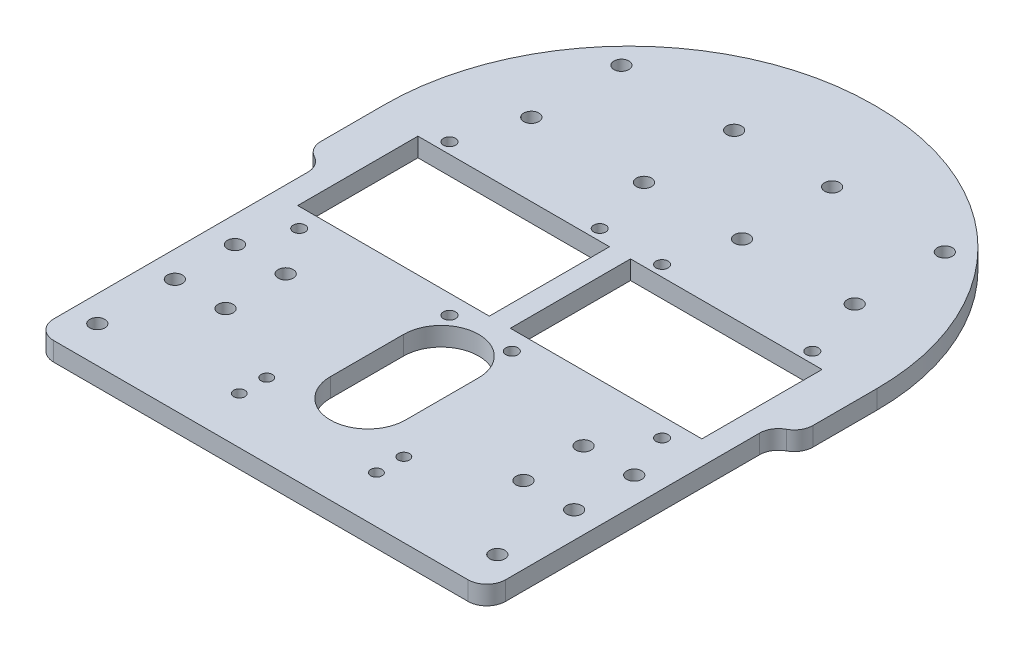
from build123d import *

# Parameters (mm, degrees)
BOSS_EXTRUDE2_DEPTH = 5
FILLET8_R           = 65
SKETCH4_R           = 2
SKETCH4_R_2         = 1.605
SKETCH4_R_3         = 1.5
SKETCH4_W           = 51
SKETCH4_H           = 32
CUT_EXTRUDE1_DEPTH  = 5
FILLET9_R           = 5
FILLET10_R          = 5


with BuildPart() as part:
    # Sketch1 → Boss-Extrude2 (new body)
    with BuildSketch(Plane(origin=(0, 0, 0), x_dir=(1, 0, 0), z_dir=(0, 1, 0))):
        Polygon((65.5, 80), (-65.5, 80), (-65.5, -7), (-60.15, -7), (-60.15, -83.5), (60.15, -83.5), (60.15, -7), (65.5, -7), align=None)
    extrude(amount=BOSS_EXTRUDE2_DEPTH)

    # Fillet8
    fillet8_edges = [part.edges().sort_by_distance(p)[0] for p in [
        (-65.5, 2.5, -80),
        (65.5, 2.5, -80),
    ]]
    fillet(fillet8_edges, radius=FILLET8_R)

    # Sketch4 → Cut-Extrude1 (cut)
    with BuildSketch(Plane(origin=(0, 5, 0), x_dir=(1, 0, 0), z_dir=(0, 1, 0))):
        with Locations(Location((-39.65, -37.25, 0), (0, 0, 270))):
            Circle(SKETCH4_R)
        with Locations(Location((39.65, -37.25, 0), (0, 0, 90))):
            Circle(SKETCH4_R)
        with Locations(Location((39.65, -53.25, 0), (0, 0, 270))):
            Circle(SKETCH4_R)
        with Locations(Location((-39.65, -53.25, 0), (0, 0, 90))):
            Circle(SKETCH4_R)
        with Locations(Location((-53.15, -37.25, 0), (0, 0, 270))):
            Circle(SKETCH4_R)
        with Locations(Location((-53.15, -53.25, 0), (0, 0, 90))):
            Circle(SKETCH4_R)
        with Locations(Location((53.15, -53.25, 0), (0, 0, 270))):
            Circle(SKETCH4_R)
        with Locations(Location((53.15, -37.25, 0), (0, 0, 90))):
            Circle(SKETCH4_R)
        with Locations(Location((-48.298883815, 15.012633239, 0), (0, 0, 270))):
            Circle(SKETCH4_R_2)
        with Locations(Location((-8.298883815, 15.012633239, 0), (0, 0, 270))):
            Circle(SKETCH4_R_2)
        with Locations(Location((-48.298883815, -24.987366761, 0), (0, 0, 270))):
            Circle(SKETCH4_R_2)
        with Locations(Location((-8.298883815, -24.987366761, 0), (0, 0, 270))):
            Circle(SKETCH4_R_2)
        with Locations(Location((48.298883815, -24.987366761, 0), (0, 0, 90))):
            Circle(SKETCH4_R_2)
        with Locations(Location((8.298883815, -24.987366761, 0), (0, 0, 90))):
            Circle(SKETCH4_R_2)
        with Locations(Location((8.298883815, 15.012633239, 0), (0, 0, 90))):
            Circle(SKETCH4_R_2)
        with Locations(Location((48.298883815, 15.012633239, 0), (0, 0, 90))):
            Circle(SKETCH4_R_2)
        with Locations(Location((13.047144734, 55.54428083, 0), (0, 0, 270))):
            Circle(SKETCH4_R)
        with Locations(Location((43.047144734, 55.54428083, 0), (0, 0, 270))):
            Circle(SKETCH4_R)
        with Locations(Location((43.047144734, 31.54428083, 0), (0, 0, 270))):
            Circle(SKETCH4_R)
        with Locations(Location((13.047144734, 31.54428083, 0), (0, 0, 270))):
            Circle(SKETCH4_R)
        with Locations(Location((-43.047144734, 55.54428083, 0), (0, 0, 90))):
            Circle(SKETCH4_R)
        with Locations(Location((-43.047144734, 31.54428083, 0), (0, 0, 90))):
            Circle(SKETCH4_R)
        with Locations(Location((-13.047144734, 31.54428083, 0), (0, 0, 90))):
            Circle(SKETCH4_R)
        with Locations(Location((-13.047144734, 55.54428083, 0), (0, 0, 90))):
            Circle(SKETCH4_R)
        with Locations(Location((-18.248740478, -71, 0), (0, 0, 270))):
            Circle(SKETCH4_R_3)
        with Locations(Location((-53.249046458, -73.796312774, 0), (0, 0, 270))):
            Circle(SKETCH4_R)
        with Locations(Location((53.249046458, -73.796312774, 0), (0, 0, 90))):
            Circle(SKETCH4_R)
        with Locations(Location((18.251259522, -71, 0), (0, 0, 270))):
            Circle(SKETCH4_R_3)
        with Locations(Location((-18.248740478, -63.7, 0), (0, 0, 270))):
            Circle(SKETCH4_R_3)
        with Locations(Location((18.25125952, -63.7, 0), (0, 0, 270))):
            Circle(SKETCH4_R_3)
        with BuildLine():
            Line((10, -35.5), (10, -55))
            ThreePointArc((10, -55), (0, -65), (-10, -55))
            Line((-10, -55), (-10, -35.5))
            ThreePointArc((-10, -35.5), (0, -25.5), (10, -35.5))
        make_face()
        with Locations((-28.298883815, -3.887366761)):
            Rectangle(SKETCH4_W, SKETCH4_H)
        with Locations((28.298883815, -3.887366761)):
            Rectangle(SKETCH4_W, SKETCH4_H)
    extrude(amount=-CUT_EXTRUDE1_DEPTH, mode=Mode.SUBTRACT)

    # Fillet9
    fillet9_edges = [part.edges().sort_by_distance(p)[0] for p in [
        (60.15, 2.5, 83.5),
        (-60.15, 2.5, 83.5),
        (-65.5, 2.5, 7),
        (65.5, 2.5, 7),
    ]]
    fillet(fillet9_edges, radius=FILLET9_R)

    # Fillet10
    fillet10_edges = [part.edges().sort_by_distance(p)[0] for p in [
        (60.15, 2.5, 7),
        (-60.15, 2.5, 7),
    ]]
    fillet(fillet10_edges, radius=FILLET10_R)


solid = part.part
